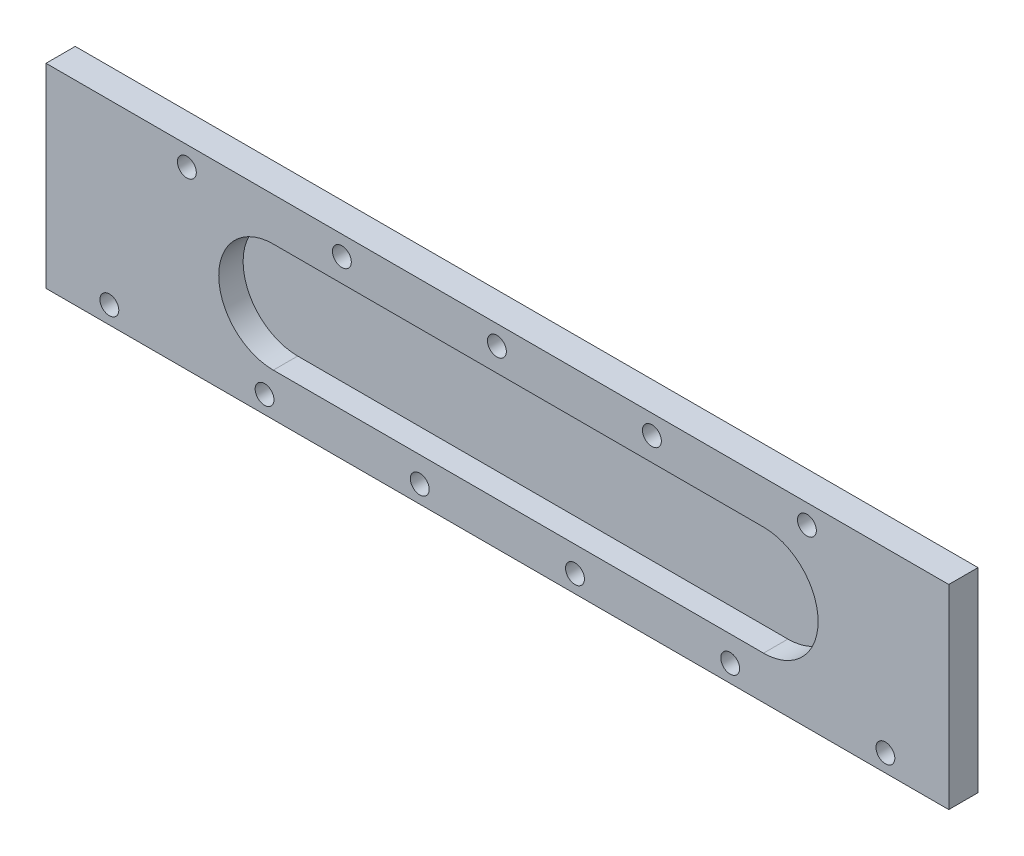
from build123d import *

# Parameters (mm, degrees)
SKETCH5_W                    = 235.204
SKETCH5_H                    = 50.8
BOSS_EXTRUDE3_DEPTH          = 7.62
CUT_EXTRUDE3_DEPTH           = 6.35
F_10_0_1935_DIAMETER_HOLE1_D = 4.9149


with BuildPart() as part:
    # Sketch5 → Boss-Extrude3 (new body)
    with BuildSketch(Plane.XY):
        with Locations((-117.602, 25.4)):
            Rectangle(SKETCH5_W, SKETCH5_H)
    extrude(amount=BOSS_EXTRUDE3_DEPTH)

    # Sketch6 → Cut-Extrude3 (cut)
    with BuildSketch(Plane.XY.offset(7.62)):
        with BuildLine():
            Line((-48.26, 11.176), (-175.975043584, 11.176))
            ThreePointArc((-175.975043584, 11.176), (-190.199043584, 25.4), (-175.975043584, 39.624))
            Line((-175.975043584, 39.624), (-48.26, 39.624))
            ThreePointArc((-48.26, 39.624), (-34.036, 25.4), (-48.26, 11.176))
        make_face()
    extrude(amount=-CUT_EXTRUDE3_DEPTH, mode=Mode.SUBTRACT)

    # #10 (0.1935) Diameter Hole1 (through all)
    with Locations(Plane(origin=(-198.501, 45.72, 7.62), x_dir=(1, 0, 0), z_dir=(0, 0, 1))):
        with Locations((0, 0), (40.386, 0), (80.772, 0), (121.158, 0), (161.544, 0), (-20.193, -41.171520692), (20.2438, -41.171520692), (60.6806, -41.171520692), (101.1174, -41.171520692), (141.5542, -41.171520692), (181.991, -41.171520692)):
            Hole(F_10_0_1935_DIAMETER_HOLE1_D / 2)


solid = part.part
